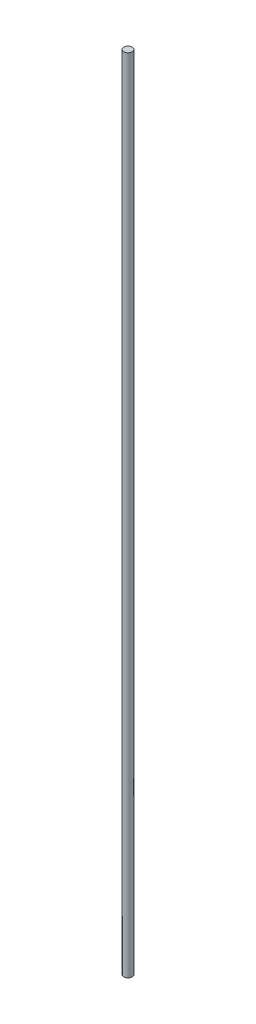
from build123d import *

# Parameters (mm, degrees)
SKETCH1_R           = 3.175
BOSS_EXTRUDE1_DEPTH = 304.8


with BuildPart() as part:
    # Sketch1 → Boss-Extrude1 (new, symmetric)
    with BuildSketch(Plane(origin=(0, 0, 0), x_dir=(1, 0, 0), z_dir=(0, 1, 0))):
        with Locations(Location((0, 0, 0), (0, 0, 90))):
            Circle(SKETCH1_R)
    extrude(amount=BOSS_EXTRUDE1_DEPTH, both=True)


solid = part.part
